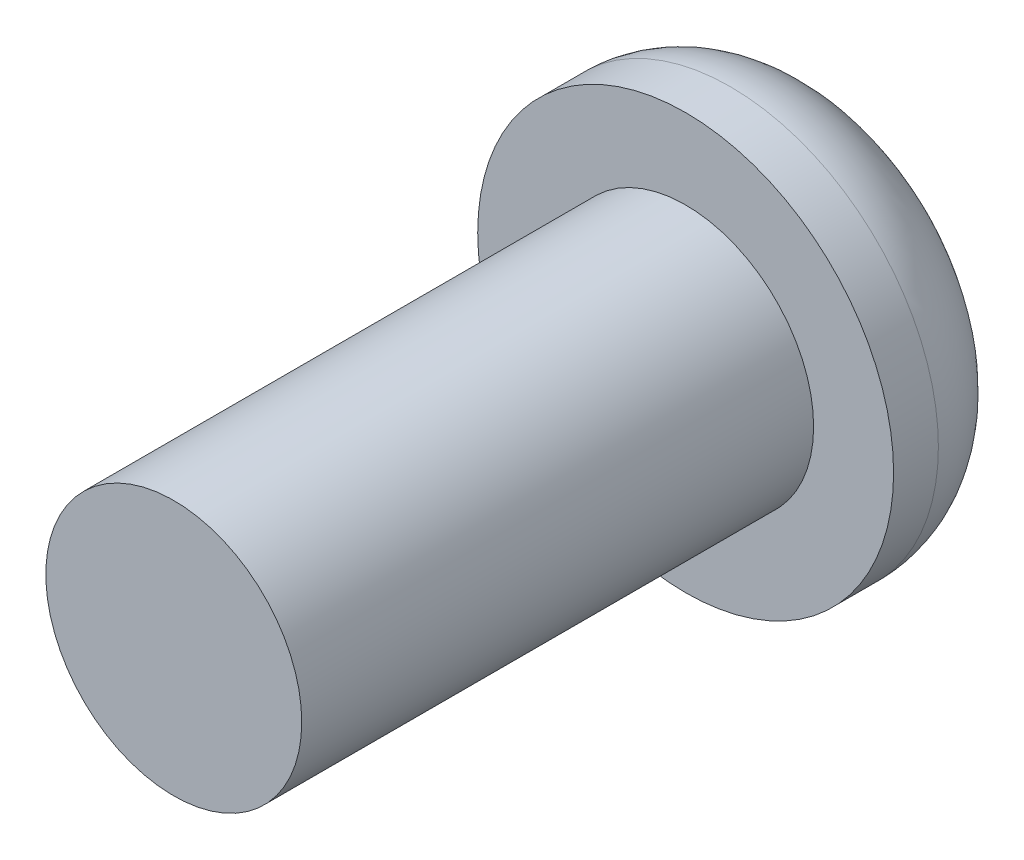
from build123d import *

# Parameters (mm, degrees)
SKETCH_1_R      = 2
EXTRUDE_1_DEPTH = 8
SKETCH_2_R      = 3.25
EXTRUDE_2_DEPTH = 2.2
FILLET_1_R      = 1.5


with BuildPart() as part:
    # 草图1 → 凸台-拉伸1 (new body)
    with BuildSketch(Plane.XY):
        Circle(SKETCH_1_R)
    extrude(amount=EXTRUDE_1_DEPTH)

    # 草图2 → 凸台-拉伸2 (add)
    with BuildSketch(Plane(origin=(0, 0, 0), x_dir=(-1, 0, 0), z_dir=(0, 0, -1))):
        Circle(SKETCH_2_R)
    extrude(amount=EXTRUDE_2_DEPTH)

    # 圆角1
    fillet_1_edges = [part.edges().sort_by_distance(p)[0] for p in [
        (3.25, 0, -2.2),
    ]]
    fillet(fillet_1_edges, radius=FILLET_1_R)


solid = part.part
